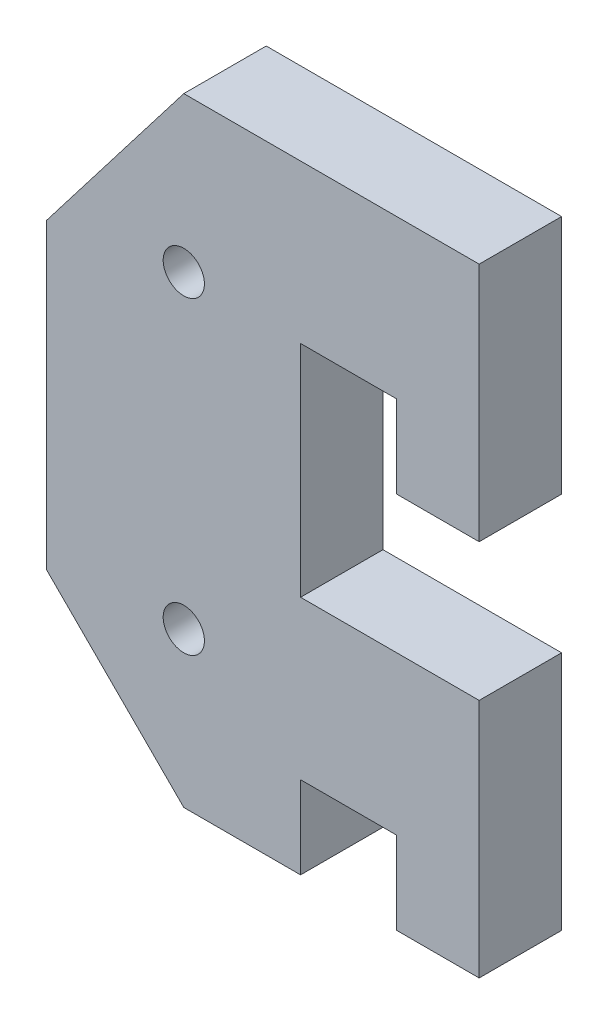
from build123d import *

# Parameters (mm, degrees)
SKETCH1_R           = 1.5
BOSS_EXTRUDE1_DEPTH = 6


with BuildPart() as part:
    # Sketch1 → Boss-Extrude1 (new body)
    with BuildSketch(Plane.XY):
        Polygon((120, -3), (130, 10), (135.5, 10), (151.5, 10), (151.5, -7.5), (145.5, -7.5), (145.5, -1.5), (138.5, -1.5), (138.5, -17.5), (151.5, -17.5), (151.5, -35), (145.5, -35), (145.5, -29), (138.5, -29), (138.5, -35), (135.5, -35), (130, -35), (120, -25), align=None)
        with Locations((130, -1.25)):
            Circle(SKETCH1_R, mode=Mode.SUBTRACT)
        with Locations((130, -23.75)):
            Circle(SKETCH1_R, mode=Mode.SUBTRACT)
    extrude(amount=BOSS_EXTRUDE1_DEPTH)


solid = part.part
